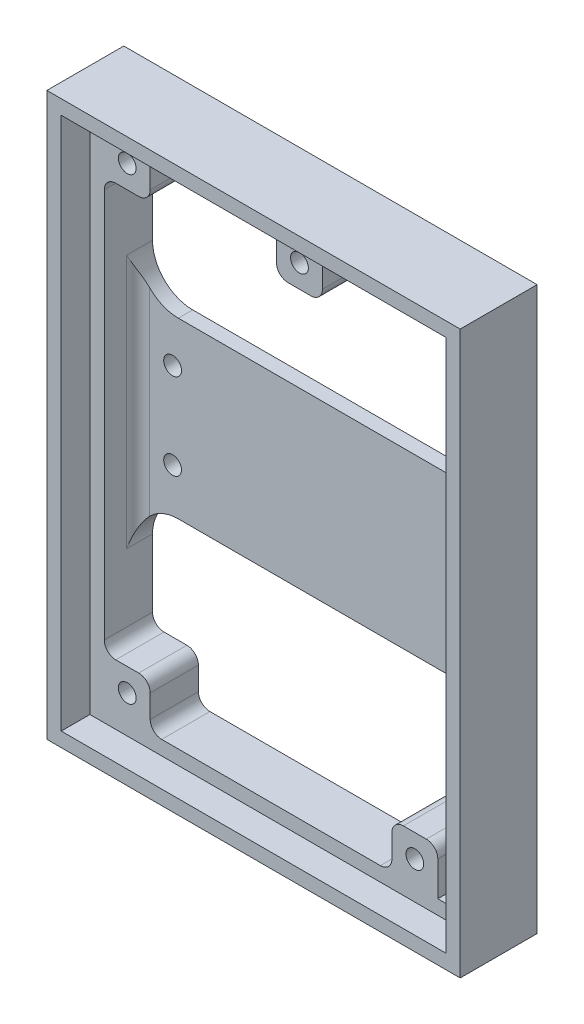
from build123d import *

# Parameters (mm, degrees)
ESQUISSE1_W             = 72
ESQUISSE1_H             = 97.9
ESQUISSE1_R             = 1.55
BOSS_EXTRU_1_DEPTH      = 8.4
ENL_V_MAT_EXTRU_1_DEPTH = 2.5
ESQUISSE3_W             = 72
ESQUISSE3_H             = 97.9
ESQUISSE3_W_2           = 67
ESQUISSE3_H_2           = 92.9
BOSS_EXTRU_2_DEPTH      = 5
ESQUISSE4_W             = 72
ESQUISSE4_H             = 30.283908022
ESQUISSE4_R             = 1.55
BOSS_EXTRU_3_DEPTH      = 2.5
CONG_2_R                = 7
CONG_4_R                = 2


with BuildPart() as part:
    # Esquisse1 → Boss.-Extru.1 (new body)
    with BuildSketch(Plane.XY):
        with Locations((12, 0)):
            Rectangle(ESQUISSE1_W, ESQUISSE1_H)
        with Locations((15, 39.95)):
            Circle(ESQUISSE1_R, mode=Mode.SUBTRACT)
        with Locations((-15, 39.95)):
            Circle(ESQUISSE1_R, mode=Mode.SUBTRACT)
        with Locations((-15, -39.95)):
            Circle(ESQUISSE1_R, mode=Mode.SUBTRACT)
        with Locations((35.1, -39.95)):
            Circle(ESQUISSE1_R, mode=Mode.SUBTRACT)
        Polygon((-19, 35.95), (-11, 35.95), (-11, 43.95), (11, 43.95), (11, 35.95), (19, 35.95), (19, 43.95), (43, 43.95), (43, -43.95), (39.1, -43.95), (39.1, -35.95), (31.1, -35.95), (31.1, -43.95), (-11, -43.95), (-11, -35.95), (-19, -35.95), align=None, mode=Mode.SUBTRACT)
    extrude(amount=BOSS_EXTRU_1_DEPTH)

    # Esquisse2 → Enlèv. mat.-Extru.1 (cut)
    with BuildSketch(Plane(origin=(0, 0, 0), x_dir=(-1, 0, 0), z_dir=(0, 0, -1))):
        Polygon((-15, 36.774573519), (-12.25, 38.36228676), (-12.25, 41.53771324), (-15, 43.125426481), (-17.75, 41.53771324), (-17.75, 38.36228676), align=None)
        Polygon((14.996275716, 36.774575703), (17.748135966, 38.359062527), (17.751860251, 41.534486823), (15.003724284, 43.125424297), (12.251864034, 41.540937473), (12.248139749, 38.365513177), align=None)
        Polygon((15, -43.125426481), (17.75, -41.53771324), (17.75, -38.36228676), (15, -36.774573519), (12.25, -38.36228676), (12.25, -41.53771324), align=None)
        Polygon((-35.1, -43.125426481), (-32.35, -41.53771324), (-32.35, -38.36228676), (-35.1, -36.774573519), (-37.85, -38.36228676), (-37.85, -41.53771324), align=None)
    extrude(amount=-ENL_V_MAT_EXTRU_1_DEPTH, mode=Mode.SUBTRACT)

    # Esquisse3 → Boss.-Extru.2 (add)
    with BuildSketch(Plane.XY.offset(8.4)):
        with Locations((12, 0)):
            Rectangle(ESQUISSE3_W, ESQUISSE3_H)
        with Locations((12, 0)):
            Rectangle(ESQUISSE3_W_2, ESQUISSE3_H_2, mode=Mode.SUBTRACT)
    extrude(amount=BOSS_EXTRU_2_DEPTH)

    # Esquisse4 → Boss.-Extru.3 (add)
    with BuildSketch(Plane(origin=(0, 0, 0), x_dir=(-1, 0, 0), z_dir=(0, 0, -1))):
        with Locations((-12, 0)):
            Rectangle(ESQUISSE4_W, ESQUISSE4_H)
        with Locations((-37, 7.5)):
            Circle(ESQUISSE4_R, mode=Mode.SUBTRACT)
        with Locations((-37, -7.5)):
            Circle(ESQUISSE4_R, mode=Mode.SUBTRACT)
        with Locations((13, -7.5)):
            Circle(ESQUISSE4_R, mode=Mode.SUBTRACT)
        with Locations((13, 7.5)):
            Circle(ESQUISSE4_R, mode=Mode.SUBTRACT)
    extrude(amount=-BOSS_EXTRU_3_DEPTH)

    # Congé2
    cong_2_edges = [part.edges().sort_by_distance(p)[0] for p in [
        (43, -15.141954011, 1.25),
        (43, 15.141954011, 1.25),
        (-19, 15.141954011, 1.25),
        (-19, -15.141954011, 1.25),
    ]]
    fillet(cong_2_edges, radius=CONG_2_R)

    # Congé4
    cong_4_edges = [part.edges().sort_by_distance(p)[0] for p in [
        (43, 0, 2.5),
        (-19, 0, 2.5),
        (-19, 35.95, 4.2),
        (-19, -35.95, 4.2),
        (-11, -35.95, 4.2),
        (-11, -43.95, 4.2),
        (31.1, -43.95, 4.2),
        (31.1, -35.95, 4.2),
        (39.1, -35.95, 4.2),
        (43, -43.95, 4.2),
        (43, 43.95, 4.2),
        (19, 43.95, 4.2),
        (19, 35.95, 4.2),
        (11, 35.95, 4.2),
        (11, 43.95, 4.2),
        (-11, 43.95, 4.2),
        (-11, 35.95, 4.2),
    ]]
    fillet(cong_4_edges, radius=CONG_4_R)


solid = part.part
